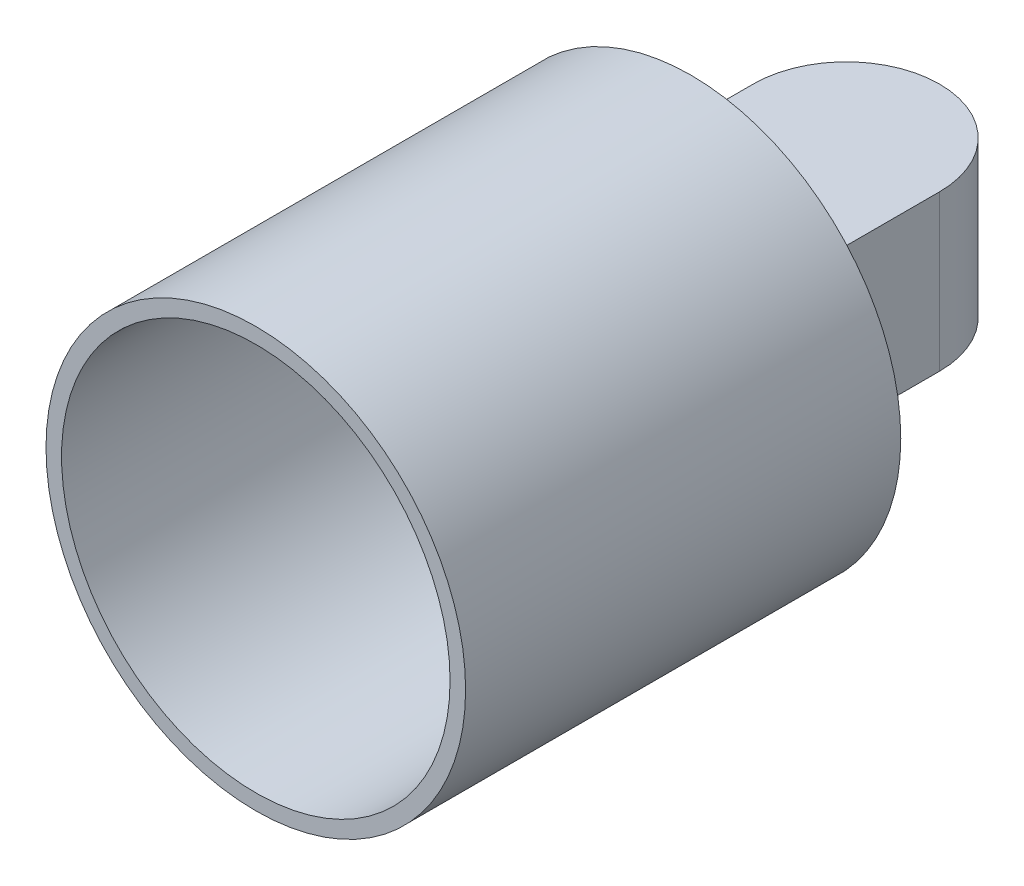
from build123d import *

# Parameters (mm, degrees)
SKETCH_1_R           = 13.5
SKETCH_1_R_2         = 12.5
EXTRUDE_1_DEPTH      = 25
SKETCH_2_R           = 13.5
EXTRUDE_2_DEPTH      = 3
EXTRUDE_3_DEPTH      = 5
EXTRUDE_3_DEPTH_BACK = 5


with BuildPart() as part:
    # 草图1 → 凸台-拉伸1 (new body)
    with BuildSketch(Plane.XY):
        Circle(SKETCH_1_R)
        Circle(SKETCH_1_R_2, mode=Mode.SUBTRACT)
    extrude(amount=-EXTRUDE_1_DEPTH)

    # 草图2 → 凸台-拉伸2 (add)
    with BuildSketch(Plane(origin=(0, 0, -25), x_dir=(-1, 0, 0), z_dir=(0, 0, -1))):
        Circle(SKETCH_2_R)
    extrude(amount=EXTRUDE_2_DEPTH)

    # 草图3 → 凸台-拉伸3 (add, two sides: drawn at the far end of the back side and taken through both)
    with BuildSketch(Plane(origin=(0, 0, 0), x_dir=(1, 0, 0), z_dir=(0, 1, 0)).offset(-EXTRUDE_3_DEPTH_BACK)):
        with BuildLine():
            Line((-6, 28), (6, 28))
            Line((6, 28), (6, 38))
            ThreePointArc((6, 38), (0, 44), (-6, 38))
            Line((-6, 38), (-6, 28))
        make_face()
    extrude(amount=EXTRUDE_3_DEPTH + EXTRUDE_3_DEPTH_BACK)


solid = part.part
